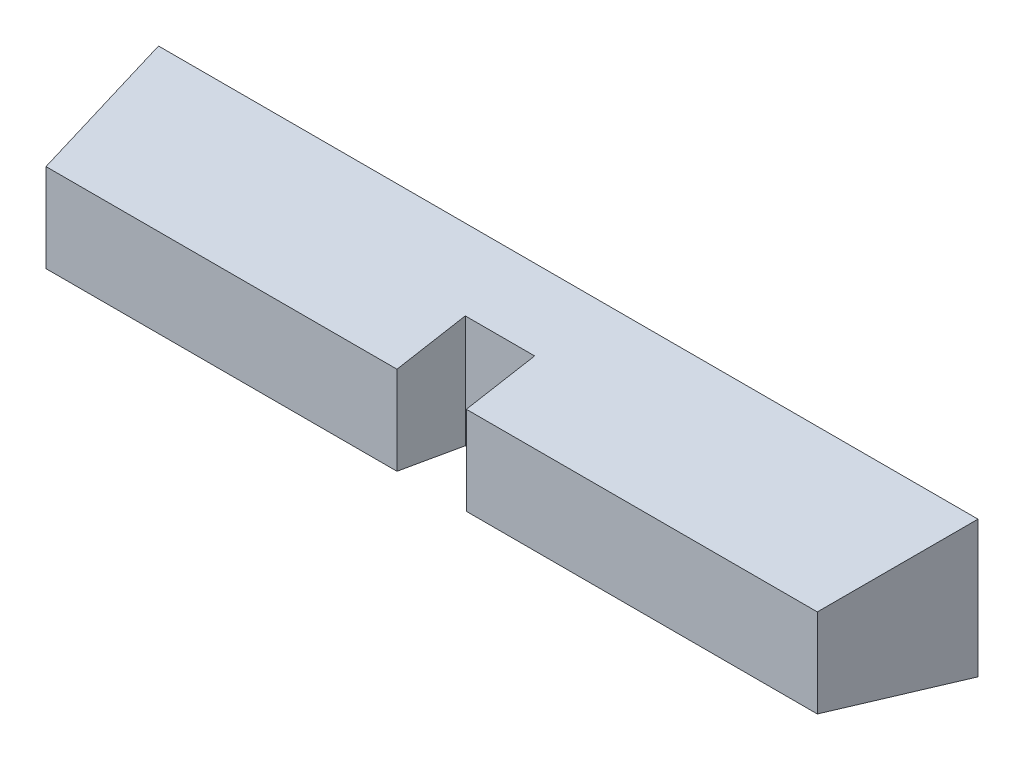
from build123d import *

# Parameters (mm, degrees)
SKETCH1_W           = 10
SKETCH1_H           = 60
BOSS_EXTRUDE1_DEPTH = 10
DRAFT1_ANGLE        = -10
SKETCH2_W           = 5.08
SKETCH2_H           = 30
CUT_EXTRUDE1_DEPTH  = 5


with BuildPart() as part:
    # Sketch1 → Boss-Extrude1 (new body)
    with BuildSketch(Plane(origin=(0, 0, 0), x_dir=(0, 1, 0), z_dir=(0, 0, 1))):
        Rectangle(SKETCH1_W, SKETCH1_H)
    extrude(amount=BOSS_EXTRUDE1_DEPTH)

    # Draft1
    draft1_faces = [part.faces().sort_by_distance(p)[0] for p in [
        (-30, 0, 5),
        (0, -5, 5),
        (0, 5, 5),
        (30, 0, 5),
    ]]
    draft(draft1_faces, Plane(origin=(0, 0, 0), x_dir=(-1, 0, 0), z_dir=(0, 0, -1)), DRAFT1_ANGLE)

    # Sketch2 → Cut-Extrude1 (cut)
    with BuildSketch(Plane.XY.offset(10)):
        Rectangle(SKETCH2_W, SKETCH2_H)
    extrude(amount=-CUT_EXTRUDE1_DEPTH, mode=Mode.SUBTRACT)


solid = part.part
